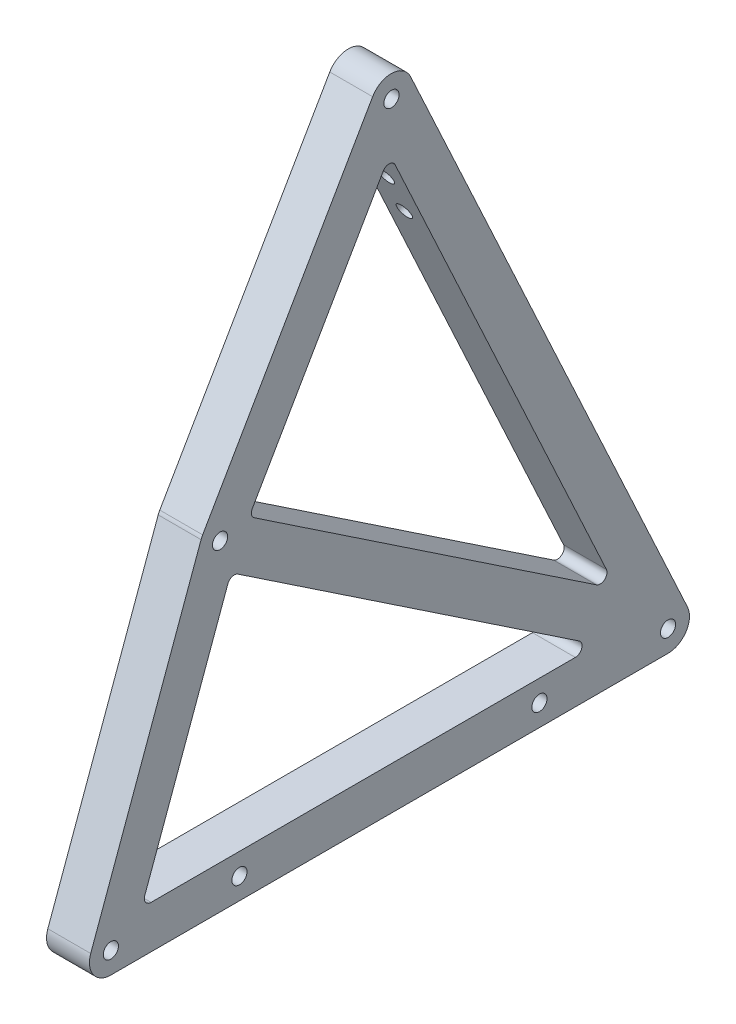
from build123d import *

# Parameters (mm, degrees)
SKETCH2_R           = 2.25
BOSS_EXTRUDE1_DEPTH = 12.7
FILLET1_R           = 6.35
FILLET2_R           = 2
CUT_EXTRUDE1_REACH  = 181.366
SKETCH3_R           = 2.25


with BuildPart() as part:
    # Sketch2 → Boss-Extrude1 (new body)
    with BuildSketch(Plane(origin=(0, 0, 0), x_dir=(0, 0, -1), z_dir=(1, 0, 0))):
        Polygon((-41.425693669, -95.25), (142.682929389, -95.25), (51.328891162, 101.953428549), (-5.433161507, 3.638669384), align=None)
        Circle(SKETCH2_R, mode=Mode.SUBTRACT)
        with Locations((50.8, 87.988181024)):
            Circle(SKETCH2_R, mode=Mode.SUBTRACT)
        with Locations((-32.356953826, -88.9)):
            Circle(SKETCH2_R, mode=Mode.SUBTRACT)
        with Locations((132.743046174, -88.9)):
            Circle(SKETCH2_R, mode=Mode.SUBTRACT)
        with Locations((5.743046174, -88.9)):
            Circle(SKETCH2_R, mode=Mode.SUBTRACT)
        with Locations((94.643046174, -88.9)):
            Circle(SKETCH2_R, mode=Mode.SUBTRACT)
        Polygon((-23.288213983, -82.55), (3.196675109, -9.783365262), (111.849821959, -82.55), align=None, mode=Mode.SUBTRACT)
        Polygon((8.615197161, 1.87277804), (117.46426423, -71.025067394), (50.271108838, 74.0229335), align=None, mode=Mode.SUBTRACT)
    extrude(amount=BOSS_EXTRUDE1_DEPTH)

    # Fillet1
    fillet1_edges = [part.edges().sort_by_distance(p)[0] for p in [
        (6.35, 3.638669384, 5.433161507),
        (6.35, 101.953428549, -51.328891162),
        (6.35, -95.25, -142.682929389),
        (6.35, -95.25, 41.425693669),
    ]]
    fillet(fillet1_edges, radius=FILLET1_R)

    # Fillet2
    fillet2_edges = [part.edges().sort_by_distance(p)[0] for p in [
        (6.35, -82.55, 23.288213983),
        (6.35, -82.55, -111.849821959),
        (6.35, -9.783365262, -3.196675109),
        (6.35, 74.0229335, -50.271108838),
        (6.35, 1.87277804, -8.615197161),
        (6.35, -71.025067394, -117.46426423),
    ]]
    fillet(fillet2_edges, radius=FILLET2_R)

    # Sketch3 → Cut-Extrude1 (cut, up to next)
    with BuildSketch(Plane(origin=(0, 37.590233469, -81.144994396), x_dir=(-1, 0, 0), z_dir=(0, 0.4203363295122346, -0.9073683761803595)), mode=Mode.PRIVATE) as cut_extrude1_sk1:
        with Locations(Location((-6.35, 33.298120023, 0), (0, 0, 90))):
            Circle(SKETCH3_R)
    cut_extrude1_tool1 = extrude(cut_extrude1_sk1.sketch, amount=-CUT_EXTRUDE1_REACH, mode=Mode.PRIVATE) & part.part
    # Sketch3 → Cut-Extrude1 (cut, up to next)
    with BuildSketch(Plane(origin=(0, 37.590233469, -81.144994396), x_dir=(-1, 0, 0), z_dir=(0, 0.4203363295122346, -0.9073683761803595)), mode=Mode.PRIVATE) as cut_extrude1_sk2:
        with Locations(Location((-6.35, 20.598120023, 0), (0, 0, 90))):
            Circle(SKETCH3_R)
    cut_extrude1_tool2 = extrude(cut_extrude1_sk2.sketch, amount=-CUT_EXTRUDE1_REACH, mode=Mode.PRIVATE) & part.part
    add(cut_extrude1_tool1.solids().sort_by_distance((6.35, 67.803895, -67.148585))[0], mode=Mode.SUBTRACT)
    add(cut_extrude1_tool2.solids().sort_by_distance((6.35, 56.280316, -72.486856))[0], mode=Mode.SUBTRACT)


solid = part.part
